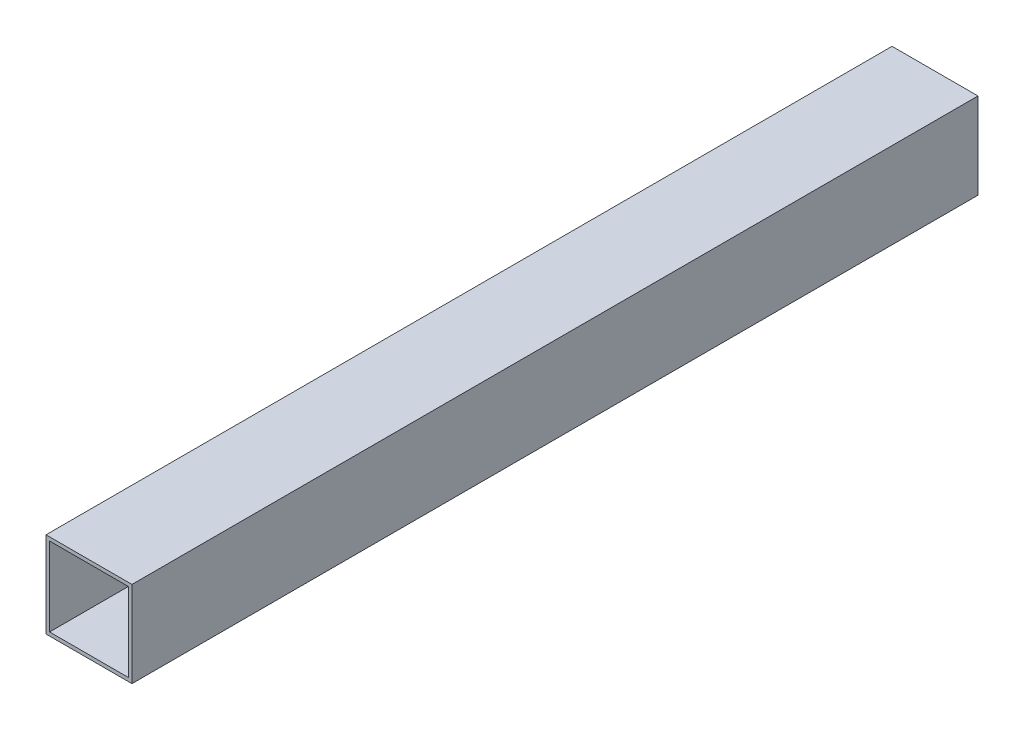
from build123d import *

# Parameters (mm, degrees)
SKETCH1_W           = 76.2
SKETCH1_H           = 76.2
SKETCH1_W_2         = 69.85
SKETCH1_H_2         = 69.85
BOSS_EXTRUDE1_DEPTH = 375


with BuildPart() as part:
    # Sketch1 → Boss-Extrude1 (new, symmetric)
    with BuildSketch(Plane.XY):
        Rectangle(SKETCH1_W, SKETCH1_H)
        Rectangle(SKETCH1_W_2, SKETCH1_H_2, mode=Mode.SUBTRACT)
    extrude(amount=BOSS_EXTRUDE1_DEPTH, both=True)


solid = part.part
